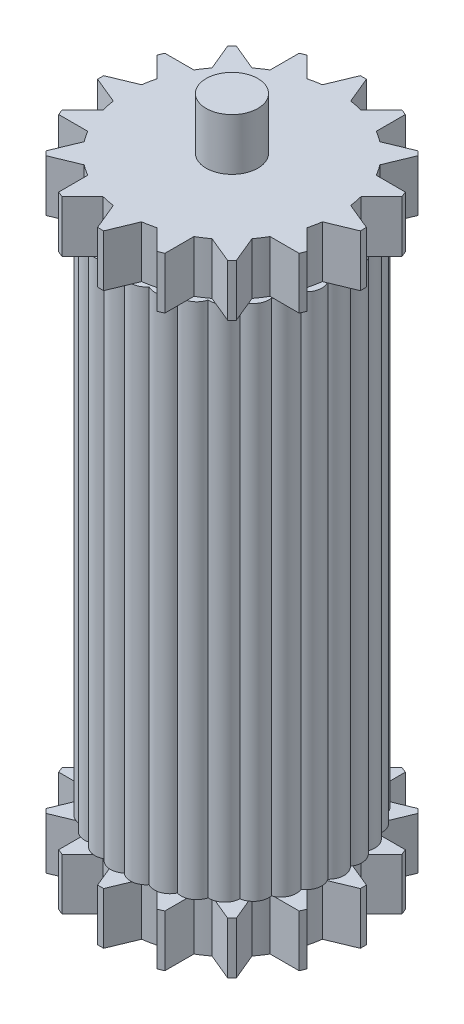
from build123d import *

# Parameters (mm, degrees)
BOSS_EXTRUDE2_DEPTH = 100
BOSS_EXTRUDE3_DEPTH = 10
SKETCH4_R           = 5
BOSS_EXTRUDE4_DEPTH = 10


with BuildPart() as part:
    # Sketch2 → Boss-Extrude2 (new body)
    with BuildSketch(Plane(origin=(0, 0, 0), x_dir=(-1, 0, 0), z_dir=(0, 1, 0))):
        with BuildLine():
            ThreePointArc((20.69149522, 2.174763782), (21.625, 0), (20.69149522, -2.174763782))
            ThreePointArc((20.69149522, -2.174763782), (21.152441866, -4.496090314), (19.78717759, -6.429243732))
            ThreePointArc((19.78717759, -6.429243732), (19.755420522, -8.795679907), (18.01806535, -10.40273488))
            ThreePointArc((18.01806535, -10.40273488), (17.494992503, -12.710856081), (15.461477194, -13.921576596))
            ThreePointArc((15.461477194, -13.921576596), (14.469949363, -16.070506851), (12.229148292, -16.831978612))
            ThreePointArc((12.229148292, -16.831978612), (10.8125, -18.727799357), (8.462346928, -19.006742394))
            ThreePointArc((8.462346928, -19.006742394), (6.682492503, -20.566597165), (4.325700396, -20.350820328))
            ThreePointArc((4.325700396, -20.350820328), (2.260428018, -21.506535987), (0, -20.80546976))
            ThreePointArc((0, -20.80546976), (-2.260428018, -21.506535987), (-4.325700396, -20.350820328))
            ThreePointArc((-4.325700396, -20.350820328), (-6.682492503, -20.566597165), (-8.462346928, -19.006742394))
            ThreePointArc((-8.462346928, -19.006742394), (-10.8125, -18.727799357), (-12.229148292, -16.831978612))
            ThreePointArc((-12.229148292, -16.831978612), (-14.469949363, -16.070506851), (-15.461477194, -13.921576596))
            ThreePointArc((-15.461477194, -13.921576596), (-17.494992503, -12.710856081), (-18.01806535, -10.40273488))
            ThreePointArc((-18.01806535, -10.40273488), (-19.755420522, -8.795679907), (-19.78717759, -6.429243732))
            ThreePointArc((-19.78717759, -6.429243732), (-21.152441866, -4.496090314), (-20.69149522, -2.174763782))
            ThreePointArc((-20.69149522, -2.174763782), (-21.625, 0), (-20.69149522, 2.174763782))
            ThreePointArc((-20.69149522, 2.174763782), (-21.152441866, 4.496090314), (-19.78717759, 6.429243732))
            ThreePointArc((-19.78717759, 6.429243732), (-19.755420522, 8.795679907), (-18.01806535, 10.40273488))
            ThreePointArc((-18.01806535, 10.40273488), (-17.494992503, 12.710856081), (-15.461477194, 13.921576596))
            ThreePointArc((-15.461477194, 13.921576596), (-14.469949363, 16.070506851), (-12.229148292, 16.831978612))
            ThreePointArc((-12.229148292, 16.831978612), (-10.8125, 18.727799357), (-8.462346928, 19.006742394))
            ThreePointArc((-8.462346928, 19.006742394), (-6.682492503, 20.566597165), (-4.325700396, 20.350820328))
            ThreePointArc((-4.325700396, 20.350820328), (-2.260428018, 21.506535987), (0, 20.80546976))
            ThreePointArc((0, 20.80546976), (2.260428018, 21.506535987), (4.325700396, 20.350820328))
            ThreePointArc((4.325700396, 20.350820328), (6.682492503, 20.566597165), (8.462346928, 19.006742394))
            ThreePointArc((8.462346928, 19.006742394), (10.8125, 18.727799357), (12.229148292, 16.831978612))
            ThreePointArc((12.229148292, 16.831978612), (14.469949363, 16.070506851), (15.461477194, 13.921576596))
            ThreePointArc((15.461477194, 13.921576596), (17.494992503, 12.710856081), (18.01806535, 10.40273488))
            ThreePointArc((18.01806535, 10.40273488), (19.755420522, 8.795679907), (19.78717759, 6.429243732))
            ThreePointArc((19.78717759, 6.429243732), (21.152441866, 4.496090314), (20.69149522, 2.174763782))
        make_face()
    extrude(amount=BOSS_EXTRUDE2_DEPTH)

    # Sketch3 → Boss-Extrude3 (add)
    with BuildSketch(Plane.XZ):
        with BuildLine():
            Line((-2.733, 20.190872591), (-0.588491123, 25.368175007))
            ThreePointArc((-0.588491123, 25.368175007), (0, 25.375), (0.588491123, 25.368175007))
            Line((0.588491123, 25.368175007), (2.733, 20.190872591))
            ThreePointArc((2.733, 20.190872591), (3.974965311, 19.983500088), (5.201749663, 19.699807751))
            Line((5.201749663, 19.699807751), (9.164285381, 23.662343469))
            ThreePointArc((9.164285381, 23.662343469), (9.710592096, 23.443443137), (10.251675188, 23.211931864))
            Line((10.251675188, 23.211931864), (10.251675188, 17.60806011))
            ThreePointArc((10.251675188, 17.60806011), (11.319743498, 16.941193351), (12.344580094, 16.20962576))
            Line((12.344580094, 16.20962576), (17.52188251, 18.354134638))
            ThreePointArc((17.52188251, 18.354134638), (17.942834573, 17.942834573), (18.354134638, 17.52188251))
            Line((18.354134638, 17.52188251), (16.20962576, 12.344580094))
            ThreePointArc((16.20962576, 12.344580094), (16.941193351, 11.319743498), (17.60806011, 10.251675188))
            Line((17.60806011, 10.251675188), (23.211931864, 10.251675188))
            ThreePointArc((23.211931864, 10.251675188), (23.443443137, 9.710592096), (23.662343469, 9.164285381))
            Line((23.662343469, 9.164285381), (19.699807751, 5.201749663))
            ThreePointArc((19.699807751, 5.201749663), (19.983500088, 3.974965311), (20.190872591, 2.733))
            Line((20.190872591, 2.733), (25.368175007, 0.588491123))
            ThreePointArc((25.368175007, 0.588491123), (25.375, 0), (25.368175007, -0.588491123))
            Line((25.368175007, -0.588491123), (20.190872591, -2.733))
            ThreePointArc((20.190872591, -2.733), (19.983500088, -3.974965311), (19.699807751, -5.201749663))
            Line((19.699807751, -5.201749663), (23.662343469, -9.164285381))
            ThreePointArc((23.662343469, -9.164285381), (23.443443137, -9.710592096), (23.211931864, -10.251675188))
            Line((23.211931864, -10.251675188), (17.60806011, -10.251675188))
            ThreePointArc((17.60806011, -10.251675188), (16.941193351, -11.319743498), (16.20962576, -12.344580094))
            Line((16.20962576, -12.344580094), (18.354134638, -17.52188251))
            ThreePointArc((18.354134638, -17.52188251), (17.942834573, -17.942834573), (17.52188251, -18.354134638))
            Line((17.52188251, -18.354134638), (12.344580094, -16.20962576))
            ThreePointArc((12.344580094, -16.20962576), (11.319743498, -16.941193351), (10.251675188, -17.60806011))
            Line((10.251675188, -17.60806011), (10.251675188, -23.211931864))
            ThreePointArc((10.251675188, -23.211931864), (9.710592096, -23.443443137), (9.164285381, -23.662343469))
            Line((9.164285381, -23.662343469), (5.201749663, -19.699807751))
            ThreePointArc((5.201749663, -19.699807751), (3.974965311, -19.983500088), (2.733, -20.190872591))
            Line((2.733, -20.190872591), (0.588491123, -25.368175007))
            ThreePointArc((0.588491123, -25.368175007), (0, -25.375), (-0.588491123, -25.368175007))
            Line((-0.588491123, -25.368175007), (-2.733, -20.190872591))
            ThreePointArc((-2.733, -20.190872591), (-3.974965311, -19.983500088), (-5.201749663, -19.699807751))
            Line((-5.201749663, -19.699807751), (-9.164285381, -23.662343469))
            ThreePointArc((-9.164285381, -23.662343469), (-9.710592096, -23.443443137), (-10.251675188, -23.211931864))
            Line((-10.251675188, -23.211931864), (-10.251675188, -17.60806011))
            ThreePointArc((-10.251675188, -17.60806011), (-11.319743498, -16.941193351), (-12.344580094, -16.20962576))
            Line((-12.344580094, -16.20962576), (-17.52188251, -18.354134638))
            ThreePointArc((-17.52188251, -18.354134638), (-17.942834573, -17.942834573), (-18.354134638, -17.52188251))
            Line((-18.354134638, -17.52188251), (-16.20962576, -12.344580094))
            ThreePointArc((-16.20962576, -12.344580094), (-16.941193351, -11.319743498), (-17.60806011, -10.251675188))
            Line((-17.60806011, -10.251675188), (-23.211931864, -10.251675188))
            ThreePointArc((-23.211931864, -10.251675188), (-23.443443137, -9.710592096), (-23.662343469, -9.164285381))
            Line((-23.662343469, -9.164285381), (-19.699807751, -5.201749663))
            ThreePointArc((-19.699807751, -5.201749663), (-19.983500088, -3.974965311), (-20.190872591, -2.733))
            Line((-20.190872591, -2.733), (-25.368175007, -0.588491123))
            ThreePointArc((-25.368175007, -0.588491123), (-25.375, 0), (-25.368175007, 0.588491123))
            Line((-25.368175007, 0.588491123), (-20.190872591, 2.733))
            ThreePointArc((-20.190872591, 2.733), (-19.983500088, 3.974965311), (-19.699807751, 5.201749663))
            Line((-19.699807751, 5.201749663), (-23.662343469, 9.164285381))
            ThreePointArc((-23.662343469, 9.164285381), (-23.443443137, 9.710592096), (-23.211931864, 10.251675188))
            Line((-23.211931864, 10.251675188), (-17.60806011, 10.251675188))
            ThreePointArc((-17.60806011, 10.251675188), (-16.941193351, 11.319743498), (-16.20962576, 12.344580094))
            Line((-16.20962576, 12.344580094), (-18.354134638, 17.52188251))
            ThreePointArc((-18.354134638, 17.52188251), (-17.942834573, 17.942834573), (-17.52188251, 18.354134638))
            Line((-17.52188251, 18.354134638), (-12.344580094, 16.20962576))
            ThreePointArc((-12.344580094, 16.20962576), (-11.319743498, 16.941193351), (-10.251675188, 17.60806011))
            Line((-10.251675188, 17.60806011), (-10.251675188, 23.211931864))
            ThreePointArc((-10.251675188, 23.211931864), (-9.710592096, 23.443443137), (-9.164285381, 23.662343469))
            Line((-9.164285381, 23.662343469), (-5.201749663, 19.699807751))
            ThreePointArc((-5.201749663, 19.699807751), (-3.974965311, 19.983500088), (-2.733, 20.190872591))
        make_face()
    boss_extrude3 = extrude(amount=BOSS_EXTRUDE3_DEPTH)

    # Mirror1: Boss-Extrude3 across plane
    add(boss_extrude3.mirror(Plane(origin=(0, 50, 0), x_dir=(0, 0, 1), z_dir=(0, -1, 0))))

    # Sketch4 → Boss-Extrude4 (add)
    with BuildSketch(Plane.XZ.offset(10)):
        with Locations(Location((0, 0, 0), (0, 0, 270))):
            Circle(SKETCH4_R)
    boss_extrude4 = extrude(amount=BOSS_EXTRUDE4_DEPTH)

    # Mirror2: Boss-Extrude4 across plane
    add(boss_extrude4.mirror(Plane(origin=(0, 50, 0), x_dir=(0, 0, 1), z_dir=(0, -1, 0))))


solid = part.part
